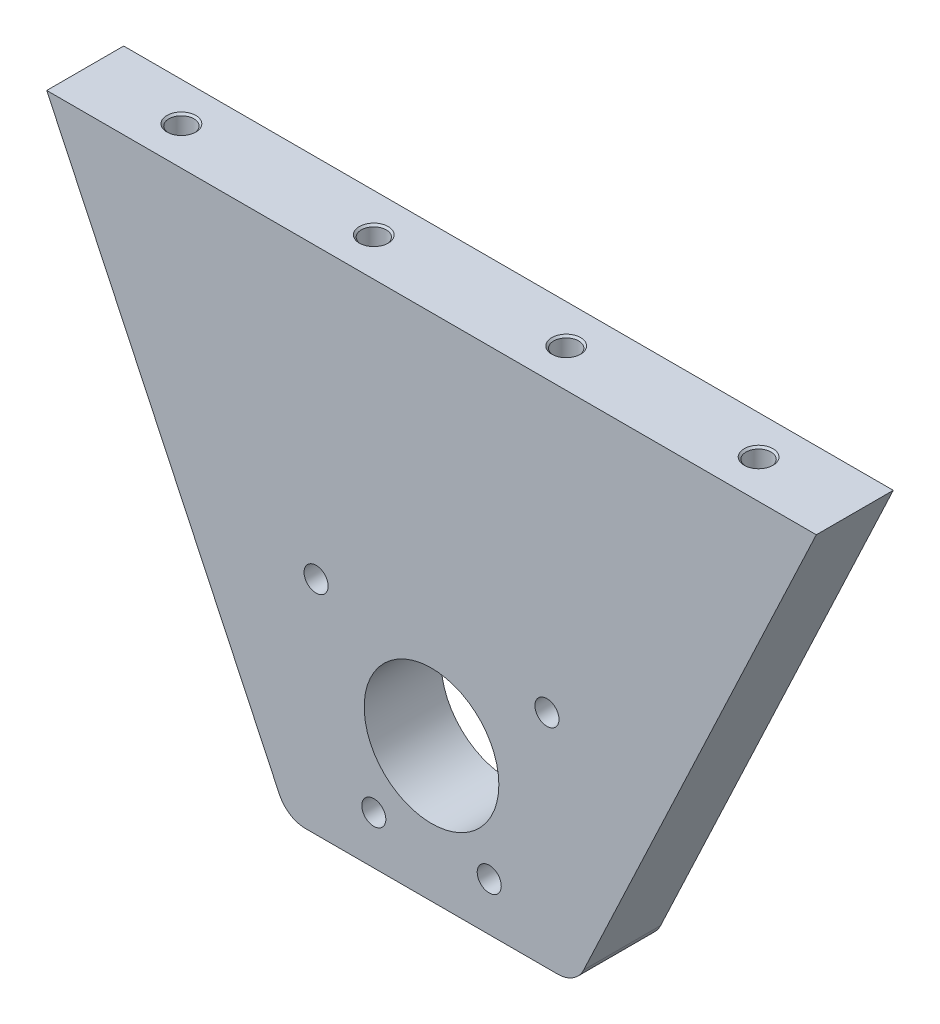
from build123d import *

# Parameters (mm, degrees)
SKETCH_1_R          = 1.25
SKETCH_1_R_2        = 7
EXTRUDE_1_DEPTH     = 8
SKETCH_2_R          = 1.3
CUT_EXTRUDE_1_DEPTH = 7.5
CHAMFER_1_SIZE      = 0.2


with BuildPart() as part:
    # 草圖1 → 填料-伸長1 (new body)
    with BuildSketch(Plane.XY):
        with BuildLine():
            Line((0, -5), (-13.098093889, -5))
            ThreePointArc((-13.098093889, -5), (-14.704398953, -4.533729275), (-15.811388666, -3.279856027))
            Line((-15.811388666, -3.279856027), (-40, 48))
            Line((-40, 48), (0, 48))
            Line((0, 48), (40, 48))
            Line((40, 48), (15.811388666, -3.279856027))
            ThreePointArc((15.811388666, -3.279856027), (14.704398953, -4.533729275), (13.098093889, -5))
            Line((13.098093889, -5), (0, -5))
        make_face()
        with Locations((6, 0)):
            Circle(SKETCH_1_R, mode=Mode.SUBTRACT)
        with Locations((-6, 0)):
            Circle(SKETCH_1_R, mode=Mode.SUBTRACT)
        with Locations((-12, 18)):
            Circle(SKETCH_1_R, mode=Mode.SUBTRACT)
        with Locations((12, 18)):
            Circle(SKETCH_1_R, mode=Mode.SUBTRACT)
        with Locations((0, 9)):
            Circle(SKETCH_1_R_2, mode=Mode.SUBTRACT)
    extrude(amount=EXTRUDE_1_DEPTH)

    # 草圖2 → 除料-伸長1 (cut)
    with BuildSketch(Plane(origin=(0, 48, 0), x_dir=(1, 0, 0), z_dir=(0, 1, 0))):
        with Locations(Location((-10, -4, 0), (0, 0, 270))):
            Circle(SKETCH_2_R)
        with Locations(Location((-30, -4, 0), (0, 0, 270))):
            Circle(SKETCH_2_R)
        with Locations(Location((10, -4, 0), (0, 0, 270))):
            Circle(SKETCH_2_R)
        with Locations(Location((30, -4, 0), (0, 0, 270))):
            Circle(SKETCH_2_R)
    extrude(amount=-CUT_EXTRUDE_1_DEPTH, mode=Mode.SUBTRACT)

    # 導角1
    chamfer_1_edges = [part.edges().sort_by_distance(p)[0] for p in [
        (30, 48, 2.7),
        (10, 48, 2.7),
        (-30, 48, 2.7),
        (-10, 48, 2.7),
    ]]
    chamfer(chamfer_1_edges, length=CHAMFER_1_SIZE)


solid = part.part
